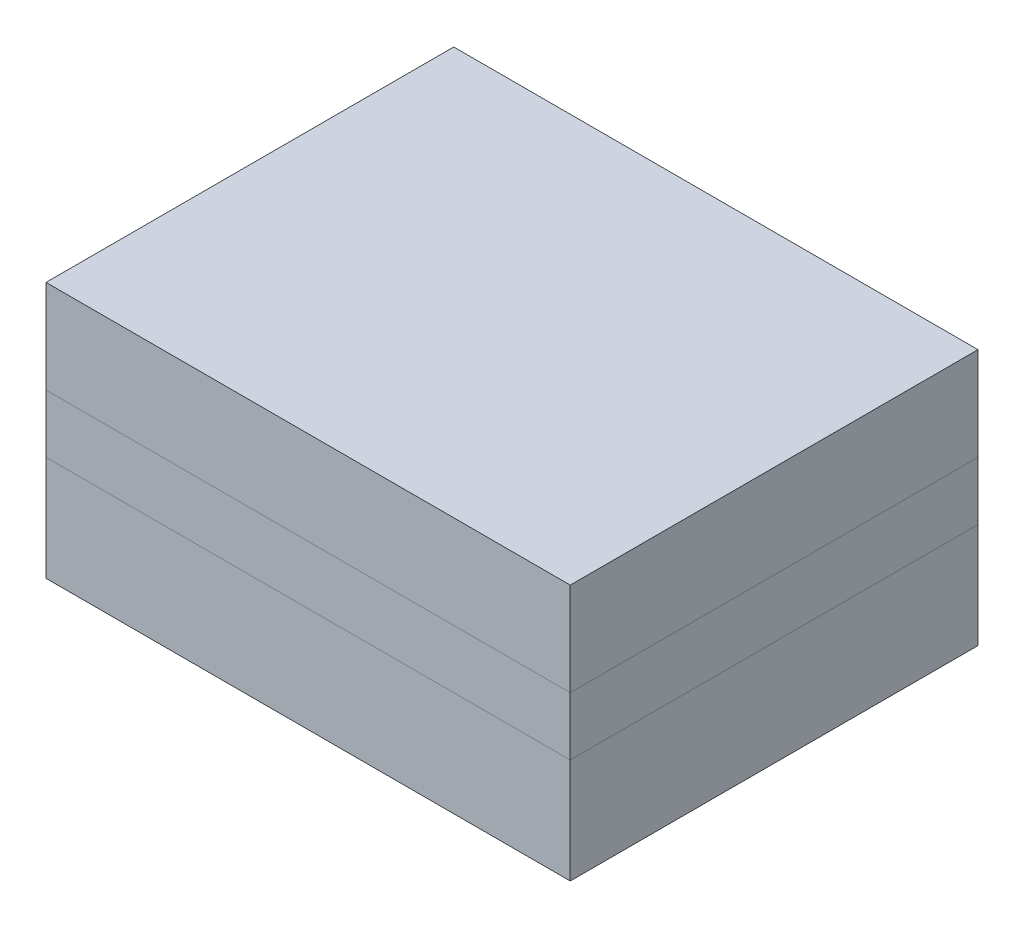
from build123d import *

# Parameters (mm, degrees)
SKETCH2_W           = 45
SKETCH2_H           = 35
BOSS_EXTRUDE1_DEPTH = 9
SKETCH5_W           = 45
SKETCH5_H           = 35
SKETCH5_W_2         = 25
SKETCH5_H_2         = 15
BOSS_EXTRUDE4_DEPTH = 5
SKETCH6_W           = 45
SKETCH6_H           = 35
BOSS_EXTRUDE5_DEPTH = 8


with BuildPart() as part:
    # Sketch2 → Boss-Extrude1 (new body)
    with BuildSketch(Plane(origin=(0, 0, 0), x_dir=(1, 0, 0), z_dir=(0, 1, 0))):
        with Locations((22.5, 17.5)):
            Rectangle(SKETCH2_W, SKETCH2_H)
    extrude(amount=BOSS_EXTRUDE1_DEPTH)


with BuildPart() as body_2:
    # Sketch5 → Boss-Extrude4 (new body)
    with BuildSketch(Plane(origin=(0, 9, 0), x_dir=(1, 0, 0), z_dir=(0, 1, 0))):
        with Locations((22.5, 17.5)):
            Rectangle(SKETCH5_W, SKETCH5_H)
        with Locations((22.5, 17.5)):
            Rectangle(SKETCH5_W_2, SKETCH5_H_2, mode=Mode.SUBTRACT)
    extrude(amount=BOSS_EXTRUDE4_DEPTH)


with BuildPart() as body_3:
    # Sketch6 → Boss-Extrude5 (new body)
    with BuildSketch(Plane(origin=(0, 14, 0), x_dir=(1, 0, 0), z_dir=(0, 1, 0))):
        with Locations((22.5, 17.5)):
            Rectangle(SKETCH6_W, SKETCH6_H)
    extrude(amount=BOSS_EXTRUDE5_DEPTH)


solid = Compound([part.part, body_2.part, body_3.part])
